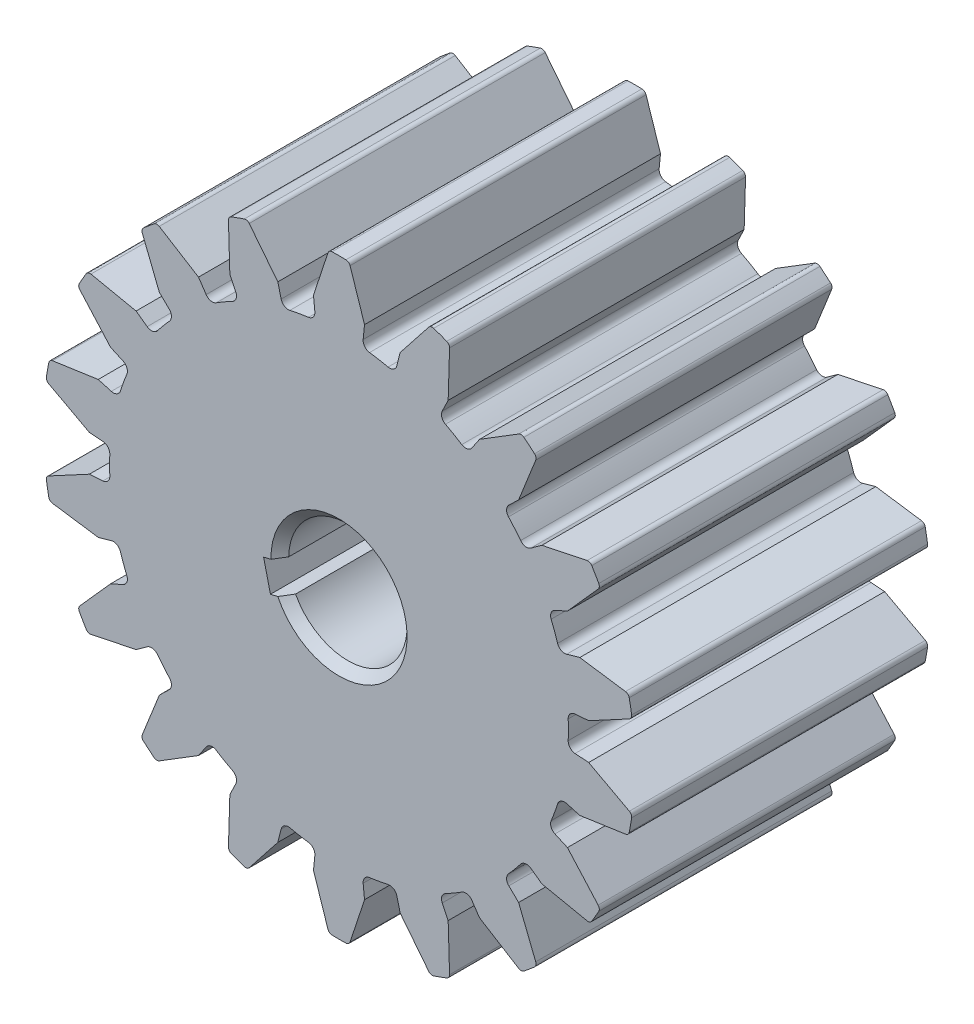
from build123d import *

# Parameters (mm, degrees)
EXTRUDE_1_DEPTH     = 20
CUT_EXTRUDE_1_DEPTH = 35.511997058


with BuildPart() as part:
    # 草图1 → 凸台-拉伸1 (new body)
    with BuildSketch(Plane.XY):
        with BuildLine():
            Line((-19.617755604, 2.700137185), (-16.870202132, 1.222898116))
            Line((-16.870202132, 1.222898116), (-15.950334154, 1.156218131))
            ThreePointArc((-15.950334154, 1.156218131), (-15.613451165, 0.990463233), (-15.486906013, 0.63697892))
            ThreePointArc((-15.486906013, 0.63697892), (-15.5, 0), (-15.486906013, -0.63697892))
            ThreePointArc((-15.486906013, -0.63697892), (-15.613451165, -0.990463233), (-15.950334154, -1.156218131))
            Line((-15.950334154, -1.156218131), (-16.870202132, -1.222898116))
            Line((-16.870202132, -1.222898116), (-19.617755604, -2.700137185))
            ThreePointArc((-19.617755604, -2.700137185), (-19.74407681, -2.830319271), (-19.772274778, -3.009509944))
            ThreePointArc((-19.772274778, -3.009509944), (-19.69615506, -3.472963553), (-19.609173727, -3.934501967))
            ThreePointArc((-19.609173727, -3.934501967), (-19.521389485, -4.093241847), (-19.358161485, -4.172368596))
            Line((-19.358161485, -4.172368596), (-16.271060244, -4.620800616))
            Line((-16.271060244, -4.620800616), (-15.383861195, -4.368845928))
            ThreePointArc((-15.383861195, -4.368845928), (-15.010603222, -4.409383815), (-14.770790921, -4.698269423))
            ThreePointArc((-14.770790921, -4.698269423), (-14.565235622, -5.301312222), (-14.335071678, -5.895398205))
            ThreePointArc((-14.335071678, -5.895398205), (-14.333086468, -6.270845796), (-14.592961413, -6.541825219))
            Line((-14.592961413, -6.541825219), (-15.434548666, -6.919097286))
            Line((-15.434548666, -6.919097286), (-17.511158871, -9.246966572))
            ThreePointArc((-17.511158871, -9.246966572), (-17.58533708, -9.412502114), (-17.550547683, -9.59053054))
            ThreePointArc((-17.550547683, -9.59053054), (-17.320508076, -10), (-17.080916925, -10.403954874))
            ThreePointArc((-17.080916925, -10.403954874), (-16.944134484, -10.523097588), (-16.763687394, -10.541625146))
            Line((-16.763687394, -10.541625146), (-13.709388354, -9.907162598))
            Line((-13.709388354, -9.907162598), (-12.961867533, -9.366962691))
            ThreePointArc((-12.961867533, -9.366962691), (-12.597254997, -9.277394098), (-12.27310045, -9.466837135))
            ThreePointArc((-12.27310045, -9.466837135), (-11.873688868, -9.96320795), (-11.454216135, -10.44274546))
            ThreePointArc((-11.454216135, -10.44274546), (-11.323940009, -10.794871809), (-11.475462156, -11.138391639))
            Line((-11.475462156, -11.138391639), (-12.137260841, -11.780751209))
            Line((-12.137260841, -11.780751209), (-13.29245794, -14.678475319))
            ThreePointArc((-13.29245794, -14.678475319), (-13.305546166, -14.859398288), (-13.211965519, -15.014791611))
            ThreePointArc((-13.211965519, -15.014791611), (-12.855752194, -15.320888862), (-12.492449453, -15.618537277))
            ThreePointArc((-12.492449453, -15.618537277), (-12.323166795, -15.683712456), (-12.147265198, -15.639406126))
            Line((-12.147265198, -15.639406126), (-9.4941619, -13.998574556))
            Line((-9.4941619, -13.998574556), (-8.976481351, -13.235285511))
            ThreePointArc((-8.976481351, -13.235285511), (-8.664491904, -13.026413734), (-8.295092933, -13.093564573))
            ThreePointArc((-8.295092933, -13.093564573), (-7.75, -13.423393759), (-7.19181308, -13.730543494))
            ThreePointArc((-7.19181308, -13.730543494), (-6.948959262, -14.016876966), (-6.973852803, -14.391503642))
            Line((-6.973852803, -14.391503642), (-7.376040232, -15.221472671))
            Line((-7.376040232, -15.221472671), (-7.470490406, -18.339543311))
            ThreePointArc((-7.470490406, -18.339543311), (-7.420910015, -18.514031727), (-7.279825325, -18.62804722))
            ThreePointArc((-7.279825325, -18.62804722), (-6.840402867, -18.793852416), (-6.397208209, -18.949293579))
            ThreePointArc((-6.397208209, -18.949293579), (-6.215843319, -18.952640135), (-6.065703545, -18.850843914))
            Line((-6.065703545, -18.850843914), (-4.133799402, -16.401551826))
            Line((-4.133799402, -16.401551826), (-3.908399039, -15.507237567))
            ThreePointArc((-3.908399039, -15.507237567), (-3.686663213, -15.204255624), (-3.316574786, -15.141014883))
            ThreePointArc((-3.316574786, -15.141014883), (-2.691546754, -15.264520172), (-2.061971228, -15.362235341))
            ThreePointArc((-2.061971228, -15.362235341), (-1.735831471, -15.548239894), (-1.63109388, -15.90878791))
            Line((-1.63109388, -15.90878791), (-1.725160312, -16.826259884))
            Line((-1.725160312, -16.826259884), (-0.747471476, -19.788591717))
            ThreePointArc((-0.747471476, -19.788591717), (-0.641202596, -19.935599702), (-0.469630758, -19.994485414))
            ThreePointArc((-0.469630758, -19.994485414), (0, -20), (0.469630758, -19.994485414))
            ThreePointArc((0.469630758, -19.994485414), (0.641202596, -19.935599702), (0.747471476, -19.788591717))
            Line((0.747471476, -19.788591717), (1.725160312, -16.826259884))
            Line((1.725160312, -16.826259884), (1.631093879, -15.90878791))
            ThreePointArc((1.631093879, -15.90878791), (1.735831471, -15.548239894), (2.061971228, -15.362235341))
            ThreePointArc((2.061971228, -15.362235341), (2.691546754, -15.264520172), (3.316574786, -15.141014883))
            ThreePointArc((3.316574786, -15.141014883), (3.686663213, -15.204255624), (3.908399039, -15.507237567))
            Line((3.908399039, -15.507237567), (4.133799402, -16.401551826))
            Line((4.133799402, -16.401551826), (6.065703545, -18.850843914))
            ThreePointArc((6.065703545, -18.850843914), (6.215843319, -18.952640135), (6.397208209, -18.949293579))
            ThreePointArc((6.397208209, -18.949293579), (6.840402867, -18.793852416), (7.279825325, -18.62804722))
            ThreePointArc((7.279825325, -18.62804722), (7.420910015, -18.514031727), (7.470490406, -18.339543311))
            Line((7.470490406, -18.339543311), (7.376040232, -15.221472671))
            Line((7.376040232, -15.221472671), (6.973852803, -14.391503642))
            ThreePointArc((6.973852803, -14.391503642), (6.948959262, -14.016876966), (7.19181308, -13.730543494))
            ThreePointArc((7.19181308, -13.730543494), (7.75, -13.423393759), (8.295092933, -13.093564573))
            ThreePointArc((8.295092933, -13.093564573), (8.664491904, -13.026413734), (8.976481351, -13.235285511))
            Line((8.976481351, -13.235285511), (9.4941619, -13.998574556))
            Line((9.4941619, -13.998574556), (12.147265198, -15.639406126))
            ThreePointArc((12.147265198, -15.639406126), (12.323166795, -15.683712456), (12.492449453, -15.618537277))
            ThreePointArc((12.492449453, -15.618537277), (12.855752194, -15.320888862), (13.211965519, -15.014791611))
            ThreePointArc((13.211965519, -15.014791611), (13.305546166, -14.859398288), (13.29245794, -14.678475319))
            Line((13.29245794, -14.678475319), (12.137260841, -11.780751209))
            Line((12.137260841, -11.780751209), (11.475462156, -11.138391639))
            ThreePointArc((11.475462156, -11.138391639), (11.323940009, -10.794871809), (11.454216135, -10.44274546))
            ThreePointArc((11.454216135, -10.44274546), (11.873688868, -9.96320795), (12.27310045, -9.466837135))
            ThreePointArc((12.27310045, -9.466837135), (12.597254997, -9.277394098), (12.961867533, -9.366962691))
            Line((12.961867533, -9.366962691), (13.709388354, -9.907162598))
            Line((13.709388354, -9.907162598), (16.763687394, -10.541625146))
            ThreePointArc((16.763687394, -10.541625146), (16.944134484, -10.523097588), (17.080916924, -10.403954874))
            ThreePointArc((17.080916924, -10.403954874), (17.320508076, -10), (17.550547683, -9.59053054))
            ThreePointArc((17.550547683, -9.59053054), (17.58533708, -9.412502114), (17.511158871, -9.246966572))
            Line((17.511158871, -9.246966572), (15.434548666, -6.919097286))
            Line((15.434548666, -6.919097286), (14.592961413, -6.541825219))
            ThreePointArc((14.592961413, -6.541825219), (14.333086468, -6.270845796), (14.335071678, -5.895398205))
            ThreePointArc((14.335071678, -5.895398205), (14.565235622, -5.301312222), (14.770790921, -4.698269423))
            ThreePointArc((14.770790921, -4.698269423), (15.010603222, -4.409383815), (15.383861195, -4.368845928))
            Line((15.383861195, -4.368845928), (16.271060244, -4.620800616))
            Line((16.271060244, -4.620800616), (19.358161485, -4.172368596))
            ThreePointArc((19.358161485, -4.172368596), (19.521389485, -4.093241847), (19.609173727, -3.934501967))
            ThreePointArc((19.609173727, -3.934501967), (19.69615506, -3.472963553), (19.772274778, -3.009509944))
            ThreePointArc((19.772274778, -3.009509944), (19.74407681, -2.830319271), (19.617755604, -2.700137185))
            Line((19.617755604, -2.700137185), (16.870202132, -1.222898116))
            Line((16.870202132, -1.222898116), (15.950334154, -1.156218131))
            ThreePointArc((15.950334154, -1.156218131), (15.613451165, -0.990463233), (15.486906013, -0.63697892))
            ThreePointArc((15.486906013, -0.63697892), (15.5, 0), (15.486906013, 0.63697892))
            ThreePointArc((15.486906013, 0.63697892), (15.613451165, 0.990463233), (15.950334154, 1.156218131))
            Line((15.950334154, 1.156218131), (16.870202132, 1.222898115))
            Line((16.870202132, 1.222898115), (19.617755604, 2.700137185))
            ThreePointArc((19.617755604, 2.700137185), (19.74407681, 2.830319271), (19.772274778, 3.009509943))
            ThreePointArc((19.772274778, 3.009509943), (19.69615506, 3.472963553), (19.609173727, 3.934501967))
            ThreePointArc((19.609173727, 3.934501967), (19.521389485, 4.093241847), (19.358161485, 4.172368595))
            Line((19.358161485, 4.172368595), (16.271060244, 4.620800616))
            Line((16.271060244, 4.620800616), (15.383861195, 4.368845928))
            ThreePointArc((15.383861195, 4.368845928), (15.010603222, 4.409383814), (14.770790921, 4.698269423))
            ThreePointArc((14.770790921, 4.698269423), (14.565235622, 5.301312221), (14.335071678, 5.895398205))
            ThreePointArc((14.335071678, 5.895398205), (14.333086468, 6.270845796), (14.592961413, 6.541825219))
            Line((14.592961413, 6.541825219), (15.434548666, 6.919097286))
            Line((15.434548666, 6.919097286), (17.511158871, 9.246966571))
            ThreePointArc((17.511158871, 9.246966571), (17.58533708, 9.412502114), (17.550547683, 9.59053054))
            ThreePointArc((17.550547683, 9.59053054), (17.320508076, 10), (17.080916924, 10.403954874))
            ThreePointArc((17.080916924, 10.403954874), (16.944134484, 10.523097588), (16.763687394, 10.541625146))
            Line((16.763687394, 10.541625146), (13.709388354, 9.907162598))
            Line((13.709388354, 9.907162598), (12.961867533, 9.36696269))
            ThreePointArc((12.961867533, 9.36696269), (12.597254997, 9.277394098), (12.27310045, 9.466837135))
            ThreePointArc((12.27310045, 9.466837135), (11.873688868, 9.96320795), (11.454216135, 10.44274546))
            ThreePointArc((11.454216135, 10.44274546), (11.323940009, 10.794871809), (11.475462156, 11.138391639))
            Line((11.475462156, 11.138391639), (12.137260841, 11.780751209))
            Line((12.137260841, 11.780751209), (13.29245794, 14.678475319))
            ThreePointArc((13.29245794, 14.678475319), (13.305546166, 14.859398288), (13.211965519, 15.014791611))
            ThreePointArc((13.211965519, 15.014791611), (12.855752194, 15.320888862), (12.492449453, 15.618537277))
            ThreePointArc((12.492449453, 15.618537277), (12.323166795, 15.683712456), (12.147265198, 15.639406126))
            Line((12.147265198, 15.639406126), (9.4941619, 13.998574556))
            Line((9.4941619, 13.998574556), (8.976481351, 13.235285511))
            ThreePointArc((8.976481351, 13.235285511), (8.664491904, 13.026413734), (8.295092933, 13.093564573))
            ThreePointArc((8.295092933, 13.093564573), (7.75, 13.423393759), (7.19181308, 13.730543493))
            ThreePointArc((7.19181308, 13.730543493), (6.948959262, 14.016876966), (6.973852803, 14.391503642))
            Line((6.973852803, 14.391503642), (7.376040232, 15.221472671))
            Line((7.376040232, 15.221472671), (7.470490406, 18.339543311))
            ThreePointArc((7.470490406, 18.339543311), (7.420910015, 18.514031727), (7.279825325, 18.62804722))
            ThreePointArc((7.279825325, 18.62804722), (6.840402867, 18.793852416), (6.397208209, 18.949293579))
            ThreePointArc((6.397208209, 18.949293579), (6.215843319, 18.952640135), (6.065703545, 18.850843914))
            Line((6.065703545, 18.850843914), (4.133799402, 16.401551825))
            Line((4.133799402, 16.401551825), (3.908399039, 15.507237567))
            ThreePointArc((3.908399039, 15.507237567), (3.686663213, 15.204255623), (3.316574786, 15.141014883))
            ThreePointArc((3.316574786, 15.141014883), (2.691546754, 15.264520172), (2.061971228, 15.36223534))
            ThreePointArc((2.061971228, 15.36223534), (1.735831471, 15.548239894), (1.631093879, 15.90878791))
            Line((1.631093879, 15.90878791), (1.725160312, 16.826259884))
            Line((1.725160312, 16.826259884), (0.747471476, 19.788591717))
            ThreePointArc((0.747471476, 19.788591717), (0.641202596, 19.935599702), (0.469630758, 19.994485413))
            ThreePointArc((0.469630758, 19.994485413), (0, 20), (-0.469630758, 19.994485413))
            ThreePointArc((-0.469630758, 19.994485413), (-0.641202596, 19.935599702), (-0.747471476, 19.788591717))
            Line((-0.747471476, 19.788591717), (-1.725160312, 16.826259884))
            Line((-1.725160312, 16.826259884), (-1.63109388, 15.90878791))
            ThreePointArc((-1.63109388, 15.90878791), (-1.735831471, 15.548239894), (-2.061971228, 15.36223534))
            ThreePointArc((-2.061971228, 15.36223534), (-2.691546754, 15.264520172), (-3.316574786, 15.141014883))
            ThreePointArc((-3.316574786, 15.141014883), (-3.686663213, 15.204255623), (-3.908399039, 15.507237567))
            Line((-3.908399039, 15.507237567), (-4.133799402, 16.401551825))
            Line((-4.133799402, 16.401551825), (-6.065703545, 18.850843914))
            ThreePointArc((-6.065703545, 18.850843914), (-6.215843319, 18.952640135), (-6.397208209, 18.949293579))
            ThreePointArc((-6.397208209, 18.949293579), (-6.840402867, 18.793852416), (-7.279825325, 18.62804722))
            ThreePointArc((-7.279825325, 18.62804722), (-7.420910015, 18.514031727), (-7.470490406, 18.339543311))
            Line((-7.470490406, 18.339543311), (-7.376040232, 15.221472671))
            Line((-7.376040232, 15.221472671), (-6.973852803, 14.391503642))
            ThreePointArc((-6.973852803, 14.391503642), (-6.948959262, 14.016876966), (-7.19181308, 13.730543493))
            ThreePointArc((-7.19181308, 13.730543493), (-7.75, 13.423393759), (-8.295092933, 13.093564573))
            ThreePointArc((-8.295092933, 13.093564573), (-8.664491904, 13.026413734), (-8.976481351, 13.235285511))
            Line((-8.976481351, 13.235285511), (-9.4941619, 13.998574556))
            Line((-9.4941619, 13.998574556), (-12.147265198, 15.639406126))
            ThreePointArc((-12.147265198, 15.639406126), (-12.323166795, 15.683712456), (-12.492449453, 15.618537277))
            ThreePointArc((-12.492449453, 15.618537277), (-12.855752194, 15.320888862), (-13.211965519, 15.014791611))
            ThreePointArc((-13.211965519, 15.014791611), (-13.305546166, 14.859398288), (-13.29245794, 14.678475319))
            Line((-13.29245794, 14.678475319), (-12.137260841, 11.780751209))
            Line((-12.137260841, 11.780751209), (-11.475462156, 11.138391639))
            ThreePointArc((-11.475462156, 11.138391639), (-11.323940009, 10.794871809), (-11.454216135, 10.44274546))
            ThreePointArc((-11.454216135, 10.44274546), (-11.873688868, 9.96320795), (-12.27310045, 9.466837135))
            ThreePointArc((-12.27310045, 9.466837135), (-12.597254997, 9.277394098), (-12.961867533, 9.36696269))
            Line((-12.961867533, 9.36696269), (-13.709388354, 9.907162598))
            Line((-13.709388354, 9.907162598), (-16.763687394, 10.541625146))
            ThreePointArc((-16.763687394, 10.541625146), (-16.944134484, 10.523097588), (-17.080916925, 10.403954874))
            ThreePointArc((-17.080916925, 10.403954874), (-17.320508076, 10), (-17.550547683, 9.59053054))
            ThreePointArc((-17.550547683, 9.59053054), (-17.58533708, 9.412502114), (-17.511158871, 9.246966571))
            Line((-17.511158871, 9.246966571), (-15.434548666, 6.919097286))
            Line((-15.434548666, 6.919097286), (-14.592961413, 6.541825219))
            ThreePointArc((-14.592961413, 6.541825219), (-14.333086468, 6.270845796), (-14.335071678, 5.895398205))
            ThreePointArc((-14.335071678, 5.895398205), (-14.565235622, 5.301312221), (-14.770790921, 4.698269423))
            ThreePointArc((-14.770790921, 4.698269423), (-15.010603222, 4.409383814), (-15.383861195, 4.368845928))
            Line((-15.383861195, 4.368845928), (-16.271060244, 4.620800616))
            Line((-16.271060244, 4.620800616), (-19.358161485, 4.172368595))
            ThreePointArc((-19.358161485, 4.172368595), (-19.521389485, 4.093241847), (-19.609173727, 3.934501967))
            ThreePointArc((-19.609173727, 3.934501967), (-19.69615506, 3.472963553), (-19.772274778, 3.009509944))
            ThreePointArc((-19.772274778, 3.009509944), (-19.74407681, 2.830319271), (-19.617755604, 2.700137185))
        make_face()
    extrude(amount=-EXTRUDE_1_DEPTH)

    # 草图2 → 切除-旋转1 (revolve, cut)
    with BuildSketch(Plane(origin=(0, 0, 0), x_dir=(0, 0, -1), z_dir=(1, 0, 0)), mode=Mode.PRIVATE) as cut_revolve_1_sk:
        Polygon((0, 0), (0, 4.6), (0.6, 4), (19.4, 4), (20, 4.6), (20, 0), align=None)
    revolve(cut_revolve_1_sk.sketch.rotate(Axis((0, 0, -20), (0, 0, 1)), 270), axis=Axis((0, 0, -20), (0, 0, 1)), mode=Mode.SUBTRACT)

    # 草图4 → 切除-拉伸1 (cut, through all)
    with BuildSketch(Plane(origin=(0, 0, -20), x_dir=(-1, 0, 0), z_dir=(0, 0, -1))):
        Polygon((5.095641584, -0.185571684), (4.63229543, -2.131159087), (-0.231673077, -0.972793701), (0.231673077, 0.972793701), align=None)
    extrude(amount=-CUT_EXTRUDE_1_DEPTH, mode=Mode.SUBTRACT)


solid = part.part
